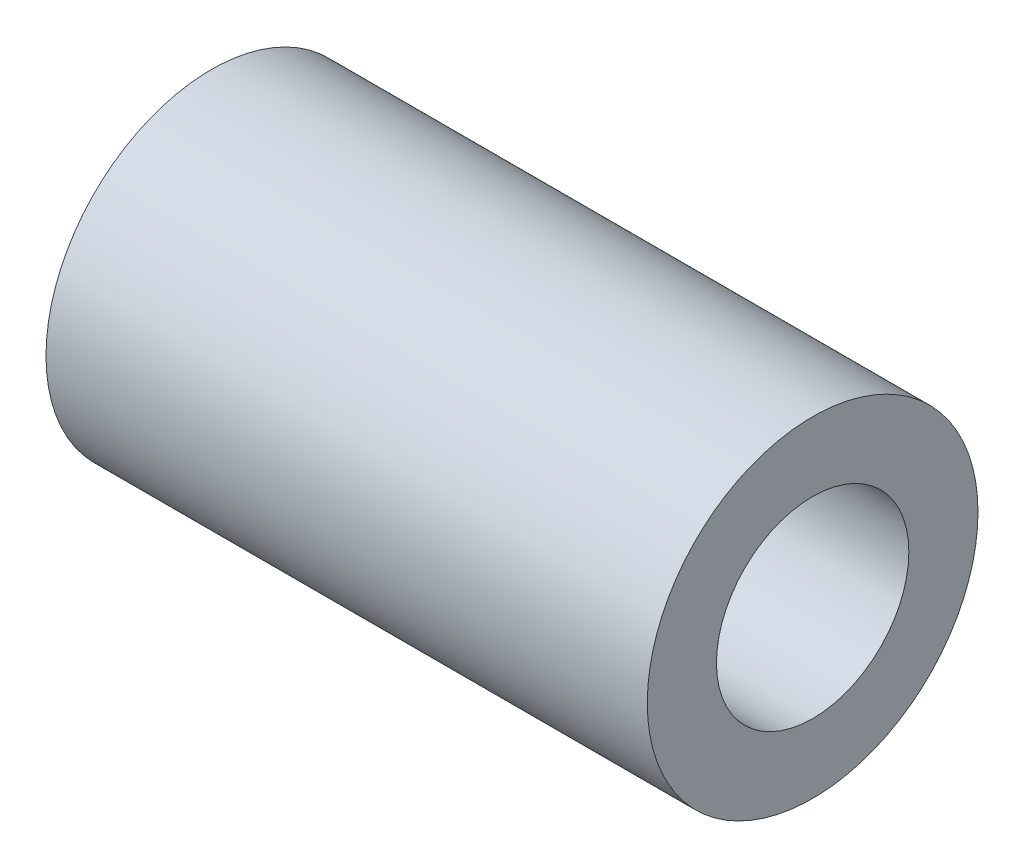
from build123d import *


with BuildPart() as part:
    # Axial profile (mm) → Full revolution (revolve)
    with BuildSketch(Plane.XY, mode=Mode.PRIVATE) as full_revolution_sk:
        Polygon((-103, 0), (-94, 0), (-94, 3.2), (-83, 3.2), (-83, 5.5), (-103, 5.5), align=None)
    revolve(full_revolution_sk.sketch.rotate(Axis((-110, 0, 0), (1, 0, 0)), 90), axis=Axis((-110, 0, 0), (1, 0, 0)))


solid = part.part
